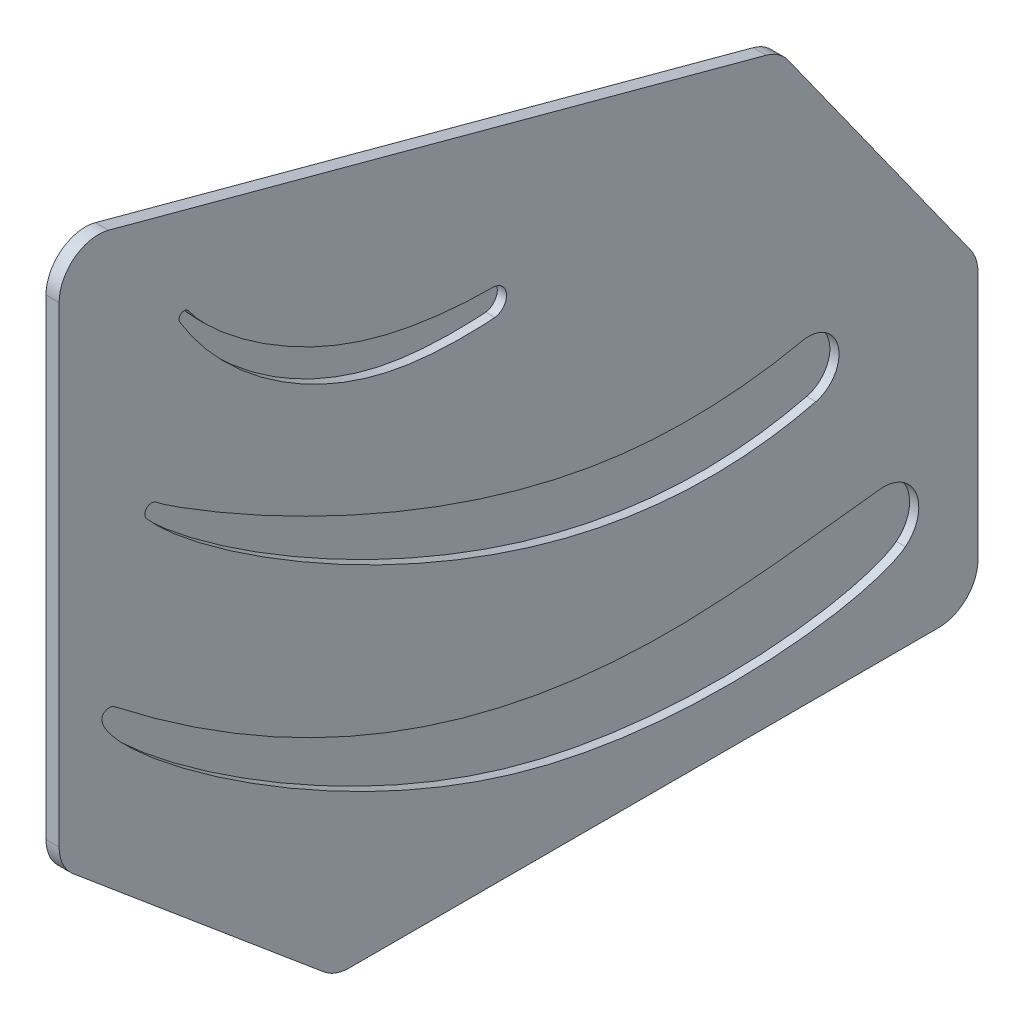
from build123d import *

# Parameters (mm, degrees)
BOSS_EXTRUDE1_DEPTH = 10
CUT_EXTRUDE2_DEPTH  = 7


with BuildPart() as part:
    # Sketch1 → Boss-Extrude1 (new body)
    with BuildSketch(Plane(origin=(0, 0, 0), x_dir=(0, 0, -1), z_dir=(1, 0, 0))):
        with BuildLine():
            Line((0, -39.159060238), (0, -399.159060238))
            ThreePointArc((0, -399.159060238), (2.810766389, -411.83760809), (10.716371709, -422.140393531))
            Line((10.716371709, -422.140393531), (202.227482489, -582.837295953))
            ThreePointArc((202.227482489, -582.837295953), (211.25050648, -588.046741283), (221.51111078, -589.855962659))
            Line((221.51111078, -589.855962659), (671.51111078, -589.855962659))
            ThreePointArc((671.51111078, -589.855962659), (692.724314215, -581.069166095), (701.51111078, -559.855962659))
            Line((701.51111078, -559.855962659), (701.51111078, -369.855962659))
            ThreePointArc((701.51111078, -369.855962659), (700.081380744, -360.705024227), (695.928465834, -352.426310564))
            Line((695.928465834, -352.426310564), (556.491249073, -157.087470131))
            ThreePointArc((556.491249073, -157.087470131), (549.188422732, -149.877866821), (539.883012979, -145.551320648))
            Line((539.883012979, -145.551320648), (37.809118961, -10.19325866))
            ThreePointArc((37.809118961, -10.19325866), (11.755460664, -15.344426409), (0, -39.159060238))
        make_face()
    extrude(amount=BOSS_EXTRUDE1_DEPTH)

    # Sketch4 → Cut-Extrude2 (cut)
    with BuildSketch(Plane(origin=(10, 0, 0), x_dir=(0, 0, -1), z_dir=(1, 0, 0))):
        with BuildLine():
            ThreePointArc((646.133694128, -523.626722446), (654.270375926, -492.315038086), (626.364411935, -475.947865394))
            add(Edge.make_bspline(
                [(626.364411935, -475.947865394), (572.427382245, -482.279425386), (369.496171973, -510.067463814), (179.998241324, -434.657283692), (42.396217675, -327.560917886)],
                knots=[0, 0, 0, 0, 0.257311007, 1, 1, 1, 1], degree=3))
            ThreePointArc((42.396217675, -327.560917886), (38.301805286, -326.1553415), (34.207392898, -327.560917886))
            add(Edge.make_bspline(
                [(34.207392898, -327.560917886), (14.475713482, -342.918185901), (324.808789115, -589.015611509), (620.265200397, -544.090123727), (646.133694128, -523.626722446)],
                knots=[0, 0, 0, 0, 0.545719307, 1, 1, 1, 1], degree=3))
        make_face()
        with BuildLine():
            ThreePointArc((332.693478174, -215.359019498), (341.545058852, -204.318697463), (331.179728441, -194.685467652))
            add(Edge.make_bspline(
                [(331.179728441, -194.685467652), (300.184384568, -194.688304583), (192.730208888, -182.13783781), (112.622758483, -114.88285895), (98.829146805, -93.988930122)],
                knots=[0, 0, 0, 0, 0.339117248, 1, 1, 1, 1], degree=3))
            ThreePointArc((98.829146805, -93.988930122), (93.433821546, -92.827514339), (92.163413905, -98.198220596))
            add(Edge.make_bspline(
                [(92.163413905, -98.198220596), (126.325036043, -154.802617957), (226.918714052, -224.562098265), (331.921739283, -215.472572374), (332.693478174, -215.359019498)],
                knots=[0, 0, 0, 0, 0.645739259, 1, 1, 1, 1], degree=3))
        make_face()
        with BuildLine():
            ThreePointArc((74.202765192, -208.284508838), (67.092959072, -208.260098077), (66.698936736, -215.359019498))
            add(Edge.make_bspline(
                [(66.698936736, -215.359019498), (100.320017518, -254.957400328), (300.322217315, -390.035120939), (509.639726303, -410.500517765), (577.755509271, -393.526935767)],
                knots=[0, 0, 0, 0, 0.654710405, 1, 1, 1, 1], degree=3))
            ThreePointArc((577.755509271, -393.526935767), (594.800287265, -365.58541059), (567.085033992, -348.175125638))
            add(Edge.make_bspline(
                [(567.085033992, -348.175125638), (526.742508558, -357.109499901), (316.076431581, -369.790908175), (81.149231878, -214.924232147), (74.202765192, -208.284508838)],
                knots=[0, 0, 0, 0, 0.231564943, 1, 1, 1, 1], degree=3))
        make_face()
    extrude(amount=-CUT_EXTRUDE2_DEPTH, mode=Mode.SUBTRACT)


solid = part.part
